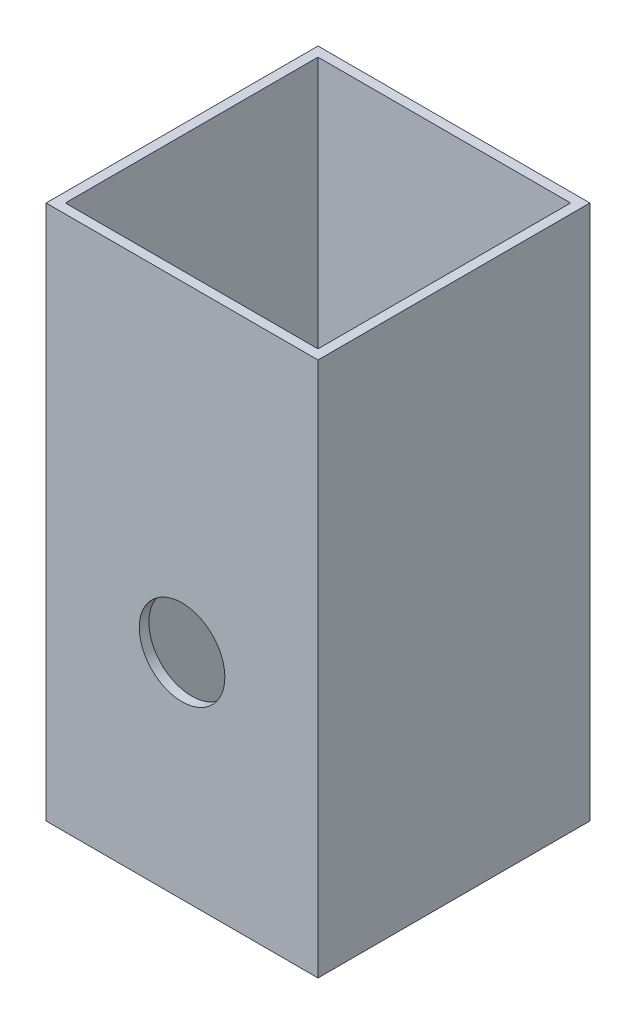
from build123d import *

# Parameters (mm, degrees)
SKETCH1_W           = 25.4
SKETCH1_H           = 25.4
SKETCH1_W_2         = 23.6
SKETCH1_H_2         = 23.6
BOSS_EXTRUDE1_DEPTH = 50
SKETCH2_R           = 4
CUT_EXTRUDE1_DEPTH  = 25.4


with BuildPart() as part:
    # Sketch1 → Boss-Extrude1 (new body)
    with BuildSketch(Plane(origin=(0, 0, 0), x_dir=(1, 0, 0), z_dir=(0, 1, 0))):
        Rectangle(SKETCH1_W, SKETCH1_H)
        Rectangle(SKETCH1_W_2, SKETCH1_H_2, mode=Mode.SUBTRACT)
    extrude(amount=BOSS_EXTRUDE1_DEPTH)

    # Sketch2 → Cut-Extrude1 (cut)
    with BuildSketch(Plane.XY.offset(12.7)):
        with Locations((0, 20)):
            Circle(SKETCH2_R)
    extrude(amount=-CUT_EXTRUDE1_DEPTH, mode=Mode.SUBTRACT)


solid = part.part
